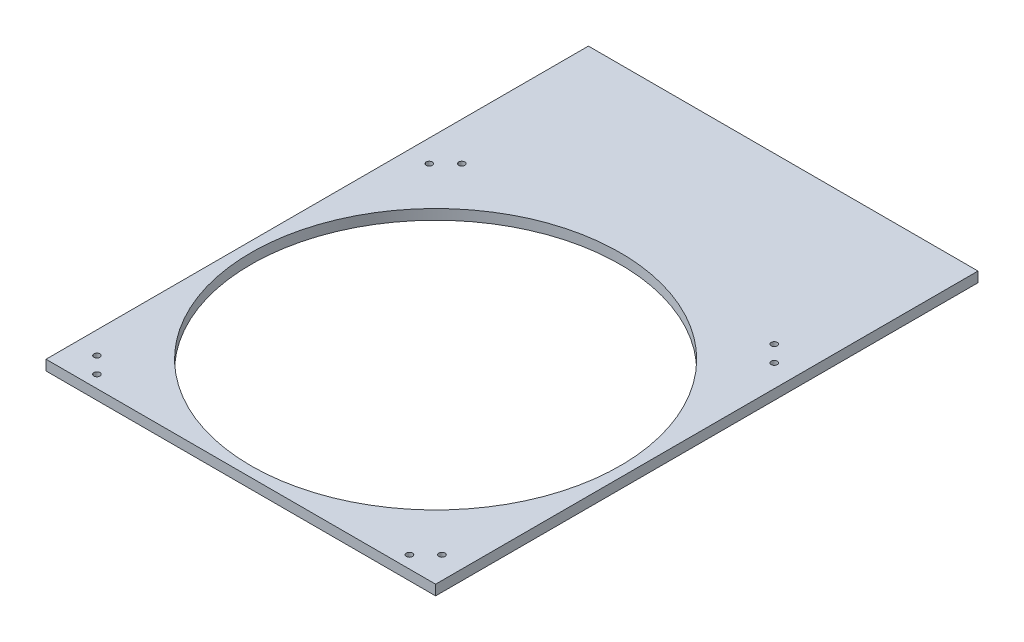
from build123d import *

# Parameters (mm, degrees)
SKETCH1_W           = 242.8875
SKETCH1_H           = 338.1375
SKETCH1_R           = 115.09375
BOSS_EXTRUDE1_DEPTH = 6.35
SKETCH7_R           = 1.905
CUT_EXTRUDE1_DEPTH  = 518.94193961


with BuildPart() as part:
    # Sketch1 → Boss-Extrude1 (new body)
    with BuildSketch(Plane(origin=(0, 0, 0), x_dir=(1, 0, 0), z_dir=(0, 1, 0))):
        with Locations((235.940705356, 205.764388046)):
            Rectangle(SKETCH1_W, SKETCH1_H)
        with Locations(Location((235.940705356, 158.139388046, 0), (0, 0, 270))):
            Circle(SKETCH1_R, mode=Mode.SUBTRACT)
    extrude(amount=BOSS_EXTRUDE1_DEPTH)

    # Sketch7 → Cut-Extrude1 (cut, through all)
    with BuildSketch(Plane.XZ):
        with Locations(Location((138.526478951, -44.416114451, 0), (0, 0, 270))):
            Circle(SKETCH7_R)
        with Locations(Location((128.389000388, -54.553593014, 0), (0, 0, 270))):
            Circle(SKETCH7_R)
        with Locations(Location((343.492410323, -54.553593014, 0), (0, 0, 90))):
            Circle(SKETCH7_R)
        with Locations(Location((333.354931761, -44.416114451, 0), (0, 0, 90))):
            Circle(SKETCH7_R)
        with Locations(Location((333.354931761, -271.862661641, 0), (0, 0, 270))):
            Circle(SKETCH7_R)
        with Locations(Location((343.492410323, -261.725183078, 0), (0, 0, 270))):
            Circle(SKETCH7_R)
        with Locations(Location((128.389000388, -261.725183078, 0), (0, 0, 90))):
            Circle(SKETCH7_R)
        with Locations(Location((138.526478951, -271.862661641, 0), (0, 0, 90))):
            Circle(SKETCH7_R)
    extrude(amount=-CUT_EXTRUDE1_DEPTH, mode=Mode.SUBTRACT)


solid = part.part
